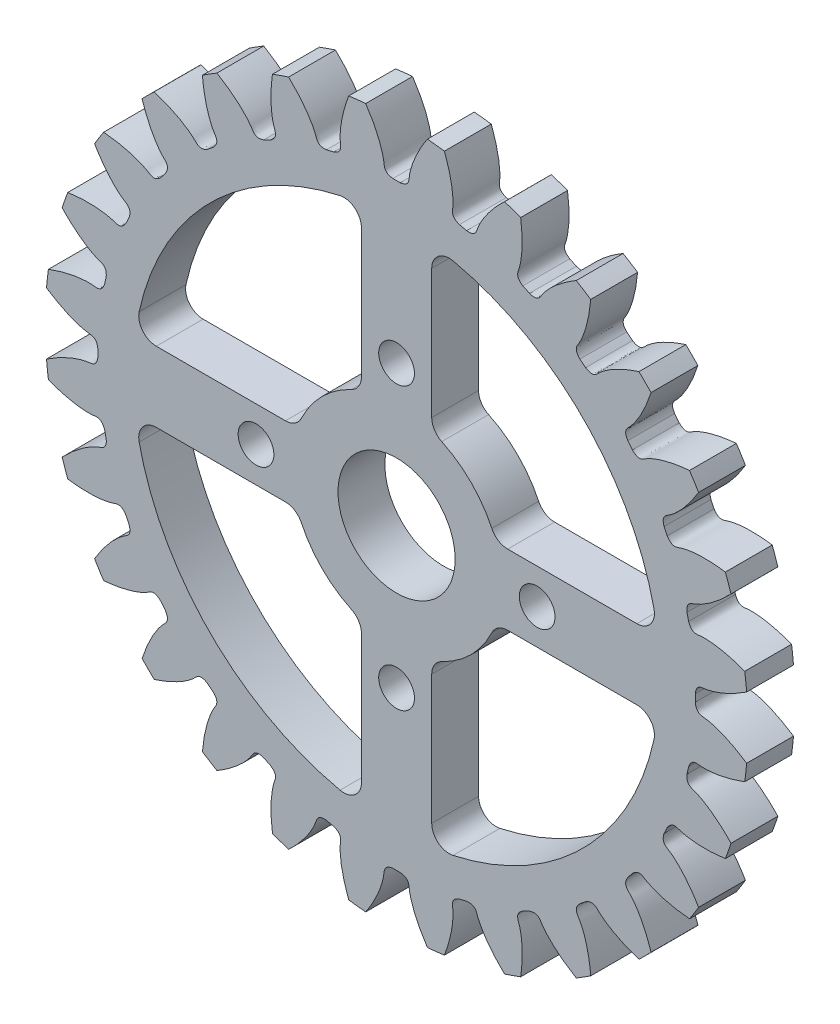
from build123d import *

# Parameters (mm, degrees)
SKETCH_1_R               = 30
EXTRUDE_1_DEPTH          = 4
CUT_EXTRUDE_1_DEPTH      = 43.614551505
PATTERN_CIRCULAR_1_COUNT = 28
SKETCH_4_R               = 5
CUT_EXTRUDE_2_DEPTH      = 5
SKETCH_5_R               = 1.525
CUT_EXTRUDE_3_DEPTH      = 4
CUT_EXTRUDE_4_DEPTH      = 4
FILLET_1_R               = 1.5


with BuildPart() as part:
    # 草图1 → 凸台-拉伸1 (new body)
    with BuildSketch(Plane.XY):
        Circle(SKETCH_1_R)
    extrude(amount=EXTRUDE_1_DEPTH)

    # 草图2 → 切除-拉伸1 (cut, through all)
    with BuildSketch(Plane.XY):
        with BuildLine():
            ThreePointArc((0.31322267, 25.498076233), (0, 25.5), (-0.31322267, 25.498076233))
            add(Edge.make_bspline(
                [(-0.31322267, 25.498076233), (-1.088461, 25.599297028), (-1.039448075, 26.037359876), (-1.107644199, 26.480509273), (-1.119341469, 26.547915557), (-1.134399597, 26.625403958), (-1.153206279, 26.712868091), (-1.176172001, 26.810183198), (-1.203695283, 26.917214364), (-1.236173513, 27.033813976), (-1.273999081, 27.159822658), (-1.317560163, 27.295069122), (-1.367240063, 27.439370362), (-1.423417008, 27.592531757), (-1.4864638, 27.754347209), (-1.556747518, 27.924599282), (-1.634629218, 28.103059351), (-1.720463626, 28.289487756), (-1.814598846, 28.483633968), (-1.917376065, 28.685236758), (-2.029129268, 28.894024372), (-2.150184952, 29.109714723), (-2.280861847, 29.332015577), (-2.421470645, 29.560624754), (-2.572313724, 29.795230336), (-2.733684891, 30.035510878), (-2.905869118, 30.281135629), (-3.089142288, 30.531764756), (-3.28377095, 30.78704958), (-3.490012075, 31.046632811), (-3.708112818, 31.310148795), (-3.938310288, 31.577223766), (-4.180831325, 31.8474761), (-4.435892279, 32.120516581), (-4.703698801, 32.395948666), (-4.984445631, 32.673368759), (-5.278316426, 32.952366493), (-5.585483466, 33.232525012), (-6.018260423, 33.611677131), (-6.355438972, 33.889447481), (-6.586497846, 34.072345445)],
                knots=[0, 0, 0, 0, 0.112672291, 0.1180235, 0.124347656, 0.131644759, 0.139914809, 0.149157806, 0.15937375, 0.170562641, 0.182724479, 0.195859265, 0.209966997, 0.225047676, 0.241101302, 0.258127876, 0.276127396, 0.295099864, 0.315045278, 0.33596364, 0.357854948, 0.380719204, 0.404556407, 0.429366557, 0.455149653, 0.481905697, 0.509634688, 0.538336626, 0.568011511, 0.598659343, 0.630280122, 0.662873848, 0.696440521, 0.730980141, 0.766492709, 0.802978223, 0.840436684, 0.878868093, 0.918272448, 1, 1, 1, 1], degree=3))
            ThreePointArc((-6.586497846, 34.072345445), (0, 34.703122021), (6.586497846, 34.072345445))
            add(Edge.make_bspline(
                [(0.31322267, 25.498076233), (1.088461, 25.599297028), (1.039448075, 26.037359876), (1.107644199, 26.480509273), (1.119341469, 26.547915557), (1.134399597, 26.625403958), (1.153206279, 26.712868091), (1.176172001, 26.810183198), (1.203695283, 26.917214364), (1.236173513, 27.033813976), (1.273999081, 27.159822658), (1.317560163, 27.295069122), (1.367240063, 27.439370362), (1.423417008, 27.592531757), (1.4864638, 27.754347209), (1.556747518, 27.924599282), (1.634629218, 28.103059351), (1.720463626, 28.289487756), (1.814598846, 28.483633968), (1.917376065, 28.685236758), (2.029129268, 28.894024372), (2.150184952, 29.109714723), (2.280861847, 29.332015577), (2.421470645, 29.560624754), (2.572313724, 29.795230336), (2.733684891, 30.035510878), (2.905869118, 30.281135629), (3.089142288, 30.531764756), (3.28377095, 30.78704958), (3.490012075, 31.046632811), (3.708112818, 31.310148795), (3.938310288, 31.577223766), (4.180831325, 31.8474761), (4.435892279, 32.120516581), (4.703698801, 32.395948666), (4.984445631, 32.673368759), (5.278316426, 32.952366493), (5.585483466, 33.232525012), (6.018260423, 33.611677131), (6.355438972, 33.889447481), (6.586497846, 34.072345445)],
                knots=[0, 0, 0, 0, 0.112672291, 0.1180235, 0.124347656, 0.131644759, 0.139914809, 0.149157806, 0.15937375, 0.170562641, 0.182724479, 0.195859265, 0.209966997, 0.225047676, 0.241101302, 0.258127876, 0.276127396, 0.295099864, 0.315045278, 0.33596364, 0.357854948, 0.380719204, 0.404556407, 0.429366557, 0.455149653, 0.481905697, 0.509634688, 0.538336626, 0.568011511, 0.598659343, 0.630280122, 0.662873848, 0.696440521, 0.730980141, 0.766492709, 0.802978223, 0.840436684, 0.878868093, 0.918272448, 1, 1, 1, 1], degree=3))
        make_face()
    cut_extrude_1 = extrude(amount=CUT_EXTRUDE_1_DEPTH, mode=Mode.SUBTRACT)

    # 阵列(圆周)1: 切除-拉伸1 ×28 about axis
    pattern_circular_1_axis = Axis((0, 0, -1.5), (0, 0, 1))
    for i in range(1, PATTERN_CIRCULAR_1_COUNT):
        add(cut_extrude_1.rotate(pattern_circular_1_axis, i * 360 / PATTERN_CIRCULAR_1_COUNT), mode=Mode.SUBTRACT)

    # 草图4 → 切除-拉伸2 (cut, symmetric)
    with BuildSketch(Plane.XY.offset(4)):
        Circle(SKETCH_4_R)
    extrude(amount=CUT_EXTRUDE_2_DEPTH, both=True, mode=Mode.SUBTRACT)

    # 草图5 → 切除-拉伸3 (cut)
    with BuildSketch(Plane.XY.offset(4)):
        with Locations((0, 12)):
            Circle(SKETCH_5_R)
        with Locations((12, 0)):
            Circle(SKETCH_5_R)
        with Locations((0, -12)):
            Circle(SKETCH_5_R)
        with Locations((-12, 0)):
            Circle(SKETCH_5_R)
    extrude(amount=-CUT_EXTRUDE_3_DEPTH, mode=Mode.SUBTRACT)

    # 草图6 → 切除-拉伸4 (cut)
    with BuildSketch(Plane(origin=(0, 0, 0), x_dir=(-1, 0, 0), z_dir=(0, 0, -1))):
        with BuildLine():
            ThreePointArc((22.299103121, 3), (15.909902577, 15.909902577), (3, 22.299103121))
            Line((3, 22.299103121), (3, 8.485281374))
            ThreePointArc((3, 8.485281374), (6.363961031, 6.363961031), (8.485281374, 3))
            Line((8.485281374, 3), (22.299103121, 3))
        make_face()
        with BuildLine():
            Line((3, -8.485281374), (3, -22.299103121))
            ThreePointArc((3, -22.299103121), (15.909902577, -15.909902577), (22.299103121, -3))
            Line((22.299103121, -3), (8.485281374, -3))
            ThreePointArc((8.485281374, -3), (6.363961031, -6.363961031), (3, -8.485281374))
        make_face()
        with BuildLine():
            Line((-8.485281374, -3), (-22.299103121, -3))
            ThreePointArc((-22.299103121, -3), (-15.909902577, -15.909902577), (-3, -22.299103121))
            Line((-3, -22.299103121), (-3, -8.485281374))
            ThreePointArc((-3, -8.485281374), (-6.363961031, -6.363961031), (-8.485281374, -3))
        make_face()
        with BuildLine():
            ThreePointArc((-3, 22.299103121), (-15.909902577, 15.909902577), (-22.299103121, 3))
            Line((-22.299103121, 3), (-8.485281374, 3))
            ThreePointArc((-8.485281374, 3), (-6.363961031, 6.363961031), (-3, 8.485281374))
            Line((-3, 8.485281374), (-3, 22.299103121))
        make_face()
    extrude(amount=-CUT_EXTRUDE_4_DEPTH, mode=Mode.SUBTRACT)

    # 圆角1
    fillet_1_edges = [part.edges().sort_by_distance(p)[0] for p in [
        (3, 8.485281374, 2),
        (8.485281374, 3, 2),
        (22.299103121, 3, 2),
        (3, 22.299103121, 2),
        (8.485281374, -3, 2),
        (3, -8.485281374, 2),
        (3, -22.299103121, 2),
        (22.299103121, -3, 2),
        (-3, -22.299103121, 2),
        (-22.299103121, -3, 2),
        (-8.485281374, -3, 2),
        (-3, -8.485281374, 2),
        (-22.299103121, 3, 2),
        (-3, 22.299103121, 2),
        (-3, 8.485281374, 2),
        (-8.485281374, 3, 2),
    ]]
    fillet(fillet_1_edges, radius=FILLET_1_R)


solid = part.part
